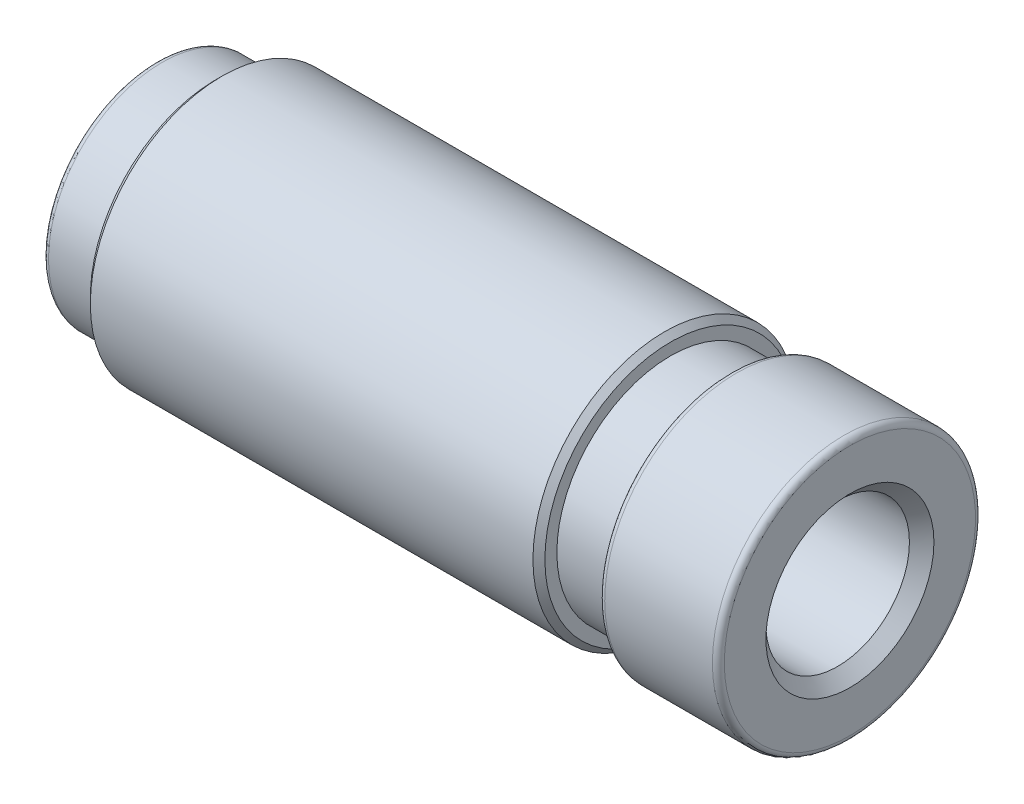
from build123d import *

# Parameters (mm, degrees)
ESBO_O2_R                        = 7
CORTE_EXTRUS_O1_DEPTH            = 25
FURO_ROSCADO_DE_M141_D           = 12
FURO_ROSCADO_DE_M141_DEPTH       = 35
FURO_ROSCADO_DE_M141_CSINK_D     = 14.05
FURO_ROSCADO_DE_M141_CSINK_ANGLE = 90
FURO_ROSCADO_DE_M141_TIP         = 3.605163714
FILETE1_R                        = 0.5
FILETE2_R                        = 1
CHANFRO1_SIZE                    = 0.5


with BuildPart() as part:
    # Esboço1 → Revolução1 (revolve)
    with BuildSketch(Plane.XY, mode=Mode.PRIVATE) as revolu_o1_sk:
        Polygon((0, 0), (58, 0), (58, 11), (48, 11), (48, 9.5), (43, 9.5), (43, 11), (5, 11), (5, 9.5), (0, 9.5), align=None)
    revolve(revolu_o1_sk.sketch.rotate(Axis((0, 0, 0), (1, 0, 0)), 90), axis=Axis((0, 0, 0), (1, 0, 0)))

    # Esboço2 → Corte-extrusão1 (cut)
    with BuildSketch(Plane.ZY):
        Circle(ESBO_O2_R)
    extrude(amount=-CORTE_EXTRUS_O1_DEPTH, mode=Mode.SUBTRACT)

    # Furo roscado de M141
    with Locations(Plane(origin=(58, 0, 0), x_dir=(0, 0, -1), z_dir=(1, 0, 0))):
        with Locations((0, 0)):
            CounterSinkHole(FURO_ROSCADO_DE_M141_D / 2, FURO_ROSCADO_DE_M141_CSINK_D / 2, depth=FURO_ROSCADO_DE_M141_DEPTH, counter_sink_angle=FURO_ROSCADO_DE_M141_CSINK_ANGLE)
            with Locations((0, 0, -(FURO_ROSCADO_DE_M141_DEPTH + FURO_ROSCADO_DE_M141_TIP / 2))):  # 118° drill point
                Cone(0, FURO_ROSCADO_DE_M141_D / 2, FURO_ROSCADO_DE_M141_TIP, mode=Mode.SUBTRACT)

    # Filete1
    filete1_edges = [part.edges().sort_by_distance(p)[0] for p in [
        (58, 0, -11),
        (0, 0, -9.5),
        (48, 0, -11),
    ]]
    fillet(filete1_edges, radius=FILETE1_R)

    # Filete2
    filete2_edges = [part.edges().sort_by_distance(p)[0] for p in [
        (0, 0, -7),
    ]]
    fillet(filete2_edges, radius=FILETE2_R)

    # Chanfro1
    chanfro1_edges = [part.edges().sort_by_distance(p)[0] for p in [
        (5, 0, -11),
        (43, 0, -11),
    ]]
    chamfer(chanfro1_edges, length=CHANFRO1_SIZE)


solid = part.part
